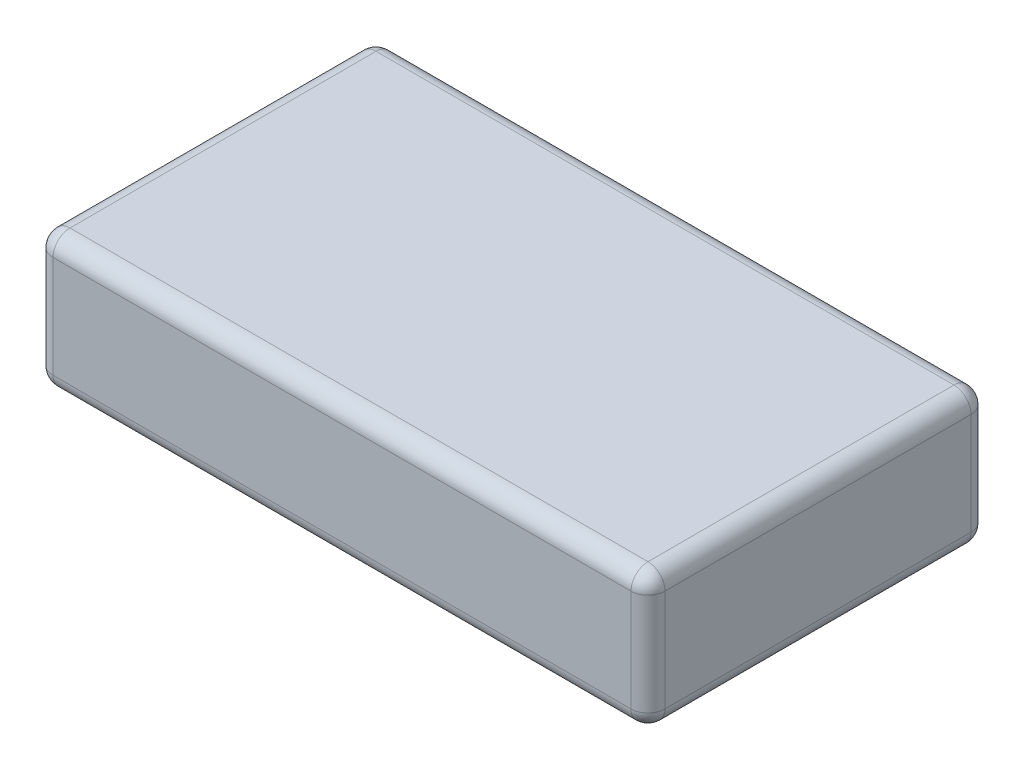
from build123d import *

# Parameters (mm, degrees)
SKETCH1_W           = 57.15
SKETCH1_H           = 31.75
BOSS_EXTRUDE1_DEPTH = 12.7
FILLET1_R           = 1.5875


with BuildPart() as part:
    # Sketch1 → Boss-Extrude1 (new body)
    with BuildSketch(Plane(origin=(0, 0, 0), x_dir=(1, 0, 0), z_dir=(0, 1, 0))):
        Rectangle(SKETCH1_W, SKETCH1_H)
    extrude(amount=BOSS_EXTRUDE1_DEPTH)

    # Fillet1
    fillet1_edges = [part.edges().sort_by_distance(p)[0] for p in [
        (28.575, 12.7, 0),
        (0, 12.7, -15.875),
        (-28.575, 12.7, 0),
        (0, 0, -15.875),
        (28.575, 0, 0),
        (0, 0, 15.875),
        (-28.575, 0, 0),
        (-28.575, 6.35, -15.875),
        (28.575, 6.35, -15.875),
        (28.575, 6.35, 15.875),
        (-28.575, 6.35, 15.875),
        (0, 12.7, 15.875),
    ]]
    fillet(fillet1_edges, radius=FILLET1_R)


solid = part.part
